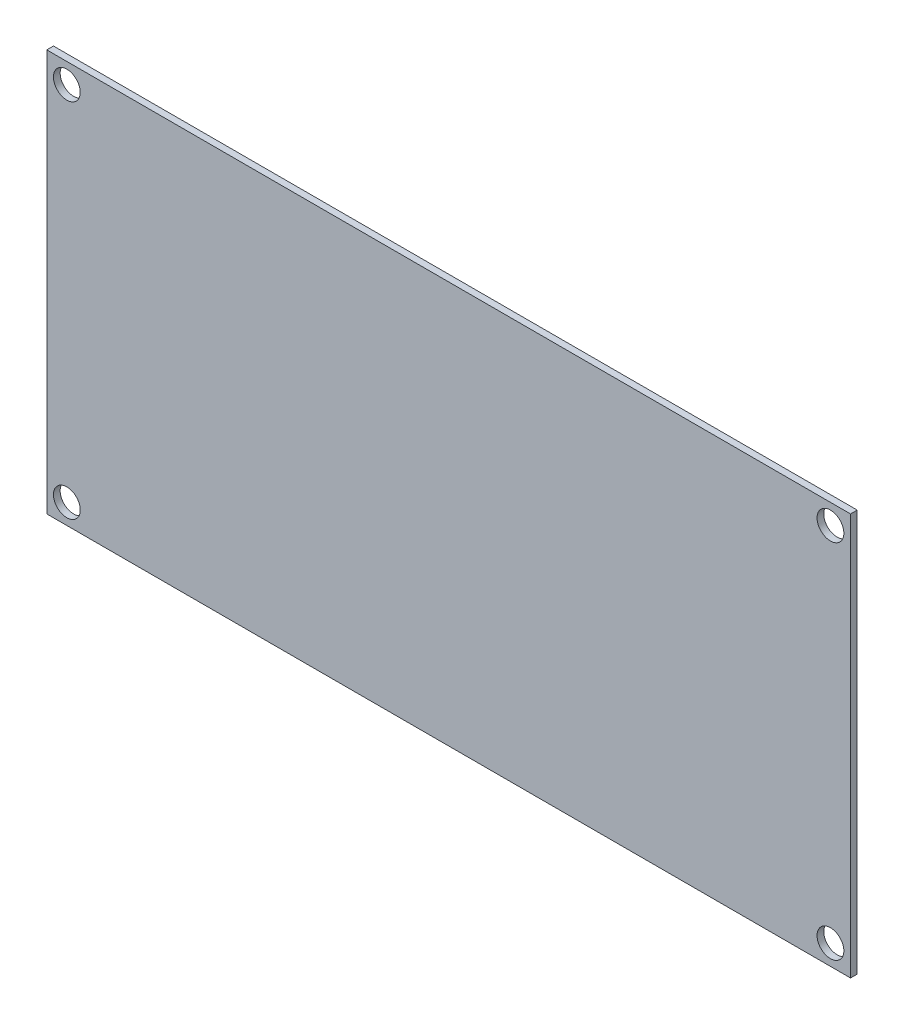
from build123d import *

# Parameters (mm, degrees)
SKETCH1_W           = 76.2
SKETCH1_H           = 38.1
BOSS_EXTRUDE1_DEPTH = 0.635
SKETCH2_R           = 1.27
CUT_EXTRUDE4_DEPTH  = 43.601827719


with BuildPart() as part:
    # Sketch1 → Boss-Extrude1 (new body)
    with BuildSketch(Plane.XY):
        Rectangle(SKETCH1_W, SKETCH1_H)
    extrude(amount=BOSS_EXTRUDE1_DEPTH)

    # Sketch2 → Cut-Extrude4 (cut, through all)
    with BuildSketch(Plane.XY.offset(0.635)):
        with Locations((-36.195, 17.145)):
            Circle(SKETCH2_R)
        with Locations((-36.195, -17.145)):
            Circle(SKETCH2_R)
        with Locations((36.195, -17.145)):
            Circle(SKETCH2_R)
        with Locations((36.195, 17.145)):
            Circle(SKETCH2_R)
    extrude(amount=-CUT_EXTRUDE4_DEPTH, mode=Mode.SUBTRACT)


solid = part.part
